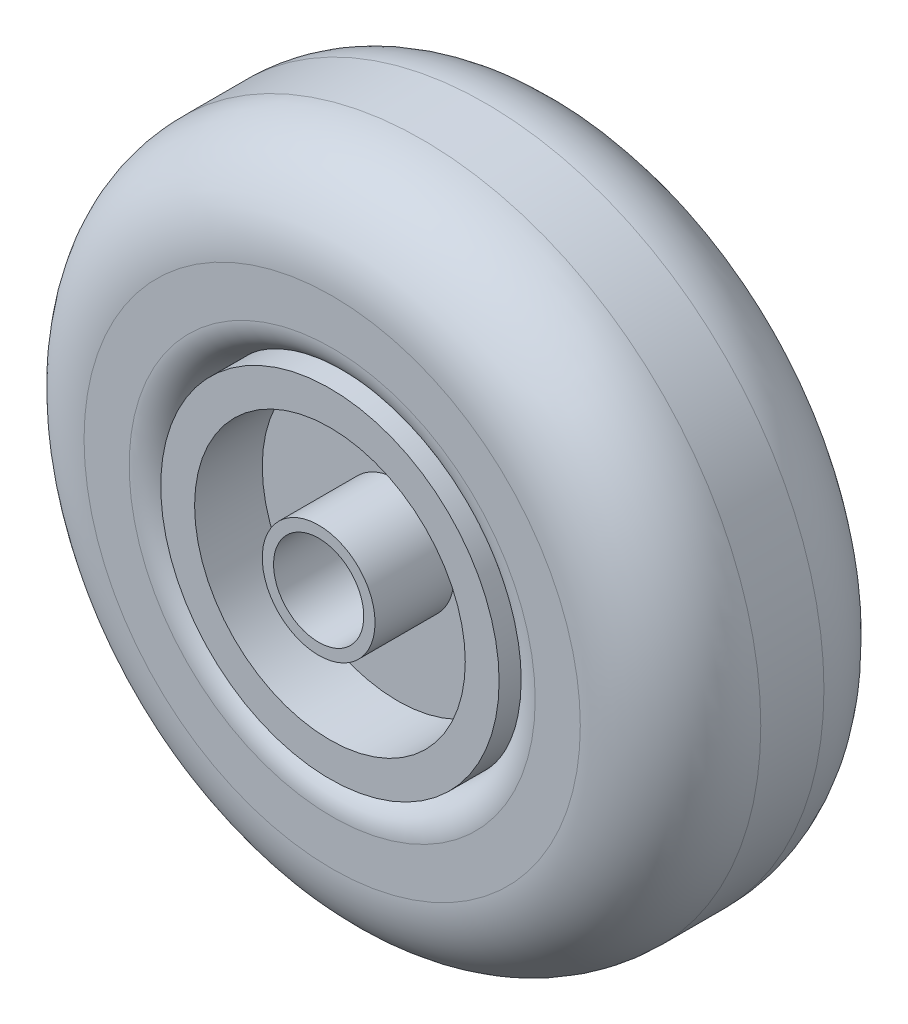
from build123d import *

# Parameters (mm, degrees)
SKETCH1_R               = 47.625
SKETCH1_R_2             = 23.8125
BOSS_EXTRUDE1_DEPTH     = 17.145
FILLET1_R               = 12.7
FILLET2_R               = 4.7625
SKETCH2_R               = 25.4
BOSS_EXTRUDE2_DEPTH     = 17.4625
SKETCH3_W               = 34.925
SKETCH3_H               = 1.5875
SKETCH4_R               = 19.05
SKETCH4_R_2             = 7.9375
CUT_EXTRUDE1_DEPTH      = 9.525
SKETCH5_R               = 7.9375
BOSS_EXTRUDE3_DEPTH     = 19.05
CUT_EXTRUDE2_DEPTH      = 77.612296113
CUT_EXTRUDE2_DEPTH_BACK = 77.612296113
SKETCH6_R               = 6.35


with BuildPart() as part:
    # Sketch1 → Boss-Extrude1 (new, symmetric)
    with BuildSketch(Plane.XY):
        Circle(SKETCH1_R)
        Circle(SKETCH1_R_2, mode=Mode.SUBTRACT)
    extrude(amount=BOSS_EXTRUDE1_DEPTH, both=True)

    # Fillet1
    fillet1_edges = [part.edges().sort_by_distance(p)[0] for p in [
        (-47.625, 0, -17.145),
        (-47.625, 0, 17.145),
    ]]
    fillet(fillet1_edges, radius=FILLET1_R)

    # Fillet2
    fillet2_edges = [part.edges().sort_by_distance(p)[0] for p in [
        (-23.8125, 0, -17.145),
        (-23.8125, 0, 17.145),
    ]]
    fillet(fillet2_edges, radius=FILLET2_R)


with BuildPart() as body_2:
    # Sketch2 → Boss-Extrude2 (new, symmetric)
    with BuildSketch(Plane.XY):
        Circle(SKETCH2_R)
    extrude(amount=BOSS_EXTRUDE2_DEPTH, both=True)

    # Sketch3 → Cut-Revolve1 (revolve, cut)
    with BuildSketch(Plane(origin=(0, 0, 0), x_dir=(0, 0, -1), z_dir=(1, 0, 0))):
        with Locations((0, 24.60625)):
            Rectangle(SKETCH3_W, SKETCH3_H)
    revolve(axis=Axis((0, 0, 0), (0, 0, -1)), mode=Mode.SUBTRACT)

    # Sketch4 → Cut-Extrude1 (cut)
    with BuildSketch(Plane(origin=(0, 0, -17.4625), x_dir=(-1, 0, 0), z_dir=(0, 0, -1))):
        Circle(SKETCH4_R)
        Circle(SKETCH4_R_2, mode=Mode.SUBTRACT)
    cut_extrude1 = extrude(amount=-CUT_EXTRUDE1_DEPTH, mode=Mode.SUBTRACT)

    # Mirror1: Cut-Extrude1 across plane
    add(cut_extrude1.mirror(Plane.XY), mode=Mode.SUBTRACT)

    # Sketch5 → Boss-Extrude3 (add, symmetric)
    with BuildSketch(Plane.XY):
        with Locations(Location((0, 0, 0), (0, 0, 180))):
            Circle(SKETCH5_R)
    extrude(amount=BOSS_EXTRUDE3_DEPTH, both=True)

    # Sketch6 → Cut-Extrude2 (cut, two sides: drawn at the far end of the back side and taken through both)
    with BuildSketch(Plane(origin=(0, 0, -17.4625), x_dir=(-1, 0, 0), z_dir=(0, 0, -1)).offset(-CUT_EXTRUDE2_DEPTH_BACK)):
        Circle(SKETCH6_R)
    extrude(amount=CUT_EXTRUDE2_DEPTH + CUT_EXTRUDE2_DEPTH_BACK, mode=Mode.SUBTRACT)


solid = Compound([part.part, body_2.part])
